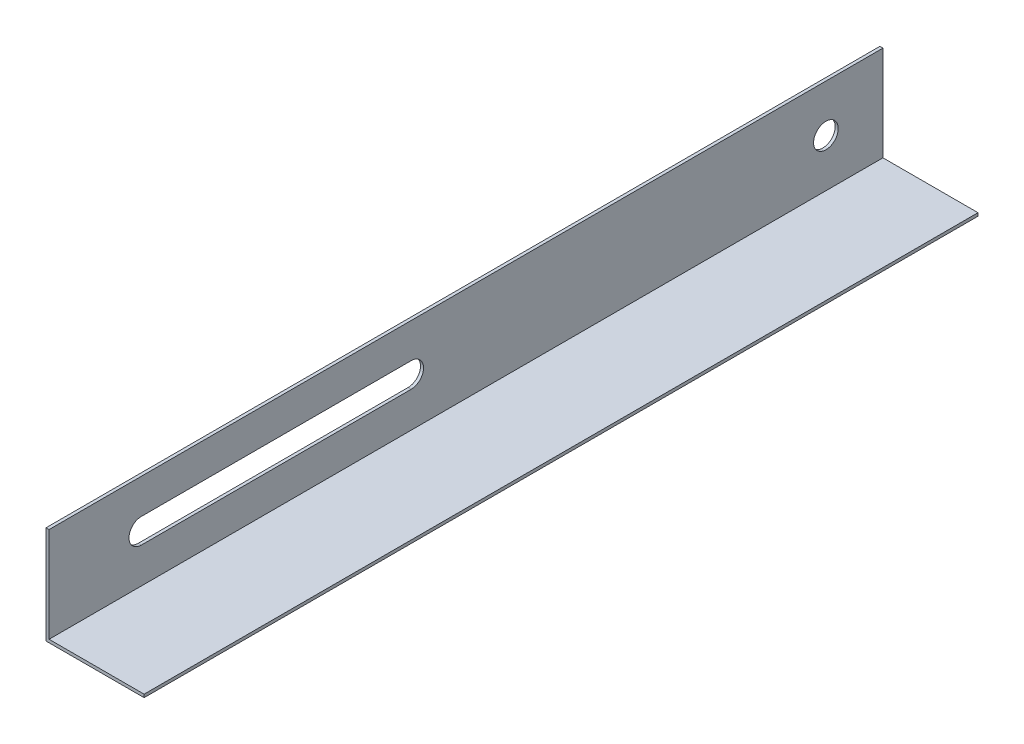
from build123d import *

# Parameters (mm, degrees)
BOSS_EXTRUDE2_DEPTH = 431.8
CUT_EXTRUDE3_DEPTH  = 127
SKETCH7_R           = 6.3881
CUT_EXTRUDE4_DEPTH  = 127


with BuildPart() as part:
    # Sketch3 → Boss-Extrude2 (new body)
    with BuildSketch(Plane.XY):
        Polygon((0, 0), (0, 49.2125), (-1.5875, 49.2125), (-1.5875, -1.5875), (49.2125, -1.5875), (49.2125, 0), align=None)
    extrude(amount=BOSS_EXTRUDE2_DEPTH)

    # Sketch6 → Cut-Extrude3 (cut)
    with BuildSketch(Plane(origin=(0, 0, 0), x_dir=(0, 0, -1), z_dir=(1, 0, 0))):
        with BuildLine():
            Line((-384.0054804, 31.187094829), (-244.3054804, 31.187094829))
            ThreePointArc((-244.3054804, 31.187094829), (-237.8919804, 24.773594829), (-244.3054804, 18.360094829))
            Line((-244.3054804, 18.360094829), (-384.0054804, 18.360094829))
            ThreePointArc((-384.0054804, 18.360094829), (-390.4189804, 24.773594829), (-384.0054804, 31.187094829))
        make_face()
    extrude(amount=-CUT_EXTRUDE3_DEPTH, mode=Mode.SUBTRACT)

    # Sketch7 → Cut-Extrude4 (cut)
    with BuildSketch(Plane(origin=(0, 0, 0), x_dir=(0, 0, -1), z_dir=(1, 0, 0))):
        with Locations(Location((-29.538792285, 24.773594829, 0), (0, 0, 90))):
            Circle(SKETCH7_R)
    extrude(amount=-CUT_EXTRUDE4_DEPTH, mode=Mode.SUBTRACT)


solid = part.part
